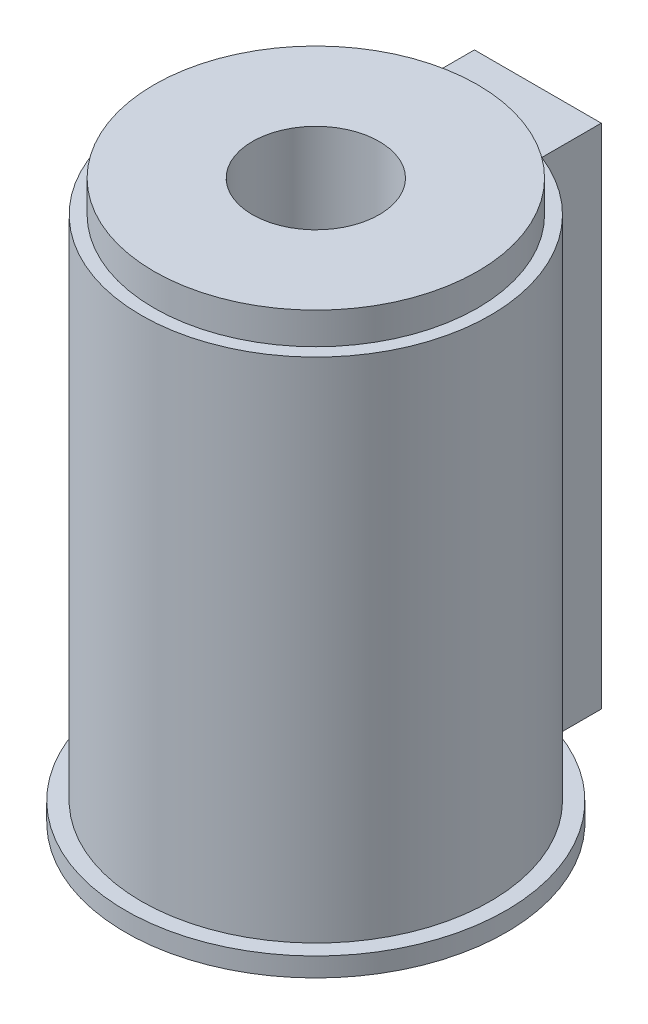
from build123d import *

# Parameters (mm, degrees)
SALIENTE_EXTRUIR1_DEPTH    = 800
SALIENTE_EXTRUIR2_DEPTH    = 800
CROQUIS2_R                 = 300
SALIENTE_EXTRUIR3_DEPTH    = 30
CROQUIS7_R                 = 255
SALIENTE_EXTRUIR4_DEPTH    = 50
CORTAR_EXTRUIR1_DEPTH      = 994.428407083
CORTAR_EXTRUIR1_DEPTH_BACK = 994.428407083
CROQUIS8_R                 = 100


with BuildPart() as part:
    # Croquis1 → Saliente-Extruir1 (new body)
    with BuildSketch(Plane(origin=(0, 0, 0), x_dir=(1, 0, 0), z_dir=(0, 1, 0))):
        with BuildLine():
            ThreePointArc((100, 256.173769149), (0, 275), (-100, 256.173769149))
            ThreePointArc((-100, 256.173769149), (-155.120920575, -227.073776557), (275, 0))
            ThreePointArc((275, 0), (227.073776557, 155.120920575), (100, 256.173769149))
        make_face()
    extrude(amount=SALIENTE_EXTRUIR1_DEPTH)

    # Croquis1<3> → Saliente-Extruir2 (add)
    with BuildSketch(Plane(origin=(0, 0, 0), x_dir=(1, 0, 0), z_dir=(0, 1, 0))):
        with BuildLine():
            Line((-100, 350), (-100, 256.173769149))
            ThreePointArc((-100, 256.173769149), (0, 275), (100, 256.173769149))
            Line((100, 256.173769149), (100, 350))
            Line((100, 350), (-100, 350))
        make_face()
    extrude(amount=SALIENTE_EXTRUIR2_DEPTH)

    # Croquis2 → Saliente-Extruir3 (add)
    with BuildSketch(Plane.XZ):
        Circle(CROQUIS2_R)
    extrude(amount=SALIENTE_EXTRUIR3_DEPTH)

    # Croquis7 → Saliente-Extruir4 (add)
    with BuildSketch(Plane(origin=(0, 800, 0), x_dir=(1, 0, 0), z_dir=(0, 1, 0))):
        Circle(CROQUIS7_R)
    extrude(amount=SALIENTE_EXTRUIR4_DEPTH)

    # Croquis8 → Cortar-Extruir1 (cut, two sides: drawn at the far end of the back side and taken through both)
    with BuildSketch(Plane(origin=(0, 850, 0), x_dir=(1, 0, 0), z_dir=(0, 1, 0)).offset(-CORTAR_EXTRUIR1_DEPTH_BACK)):
        Circle(CROQUIS8_R)
    extrude(amount=CORTAR_EXTRUIR1_DEPTH + CORTAR_EXTRUIR1_DEPTH_BACK, mode=Mode.SUBTRACT)


solid = part.part
